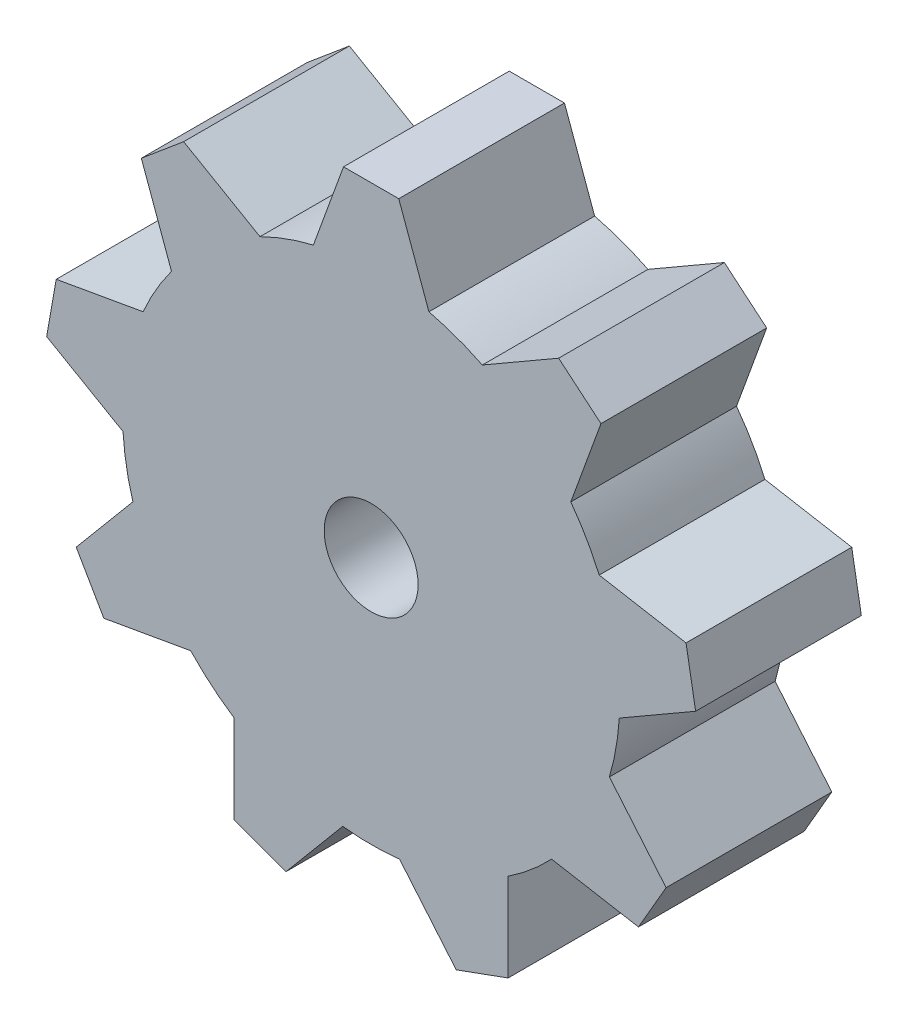
from build123d import *

# Parameters (mm, degrees)
SKETCH1_R           = 0.85
BOSS_EXTRUDE1_DEPTH = 3


with BuildPart() as part:
    # Sketch1 → Boss-Extrude1 (new body)
    with BuildSketch(Plane.XY):
        with BuildLine():
            Line((2.012075091, 4.025115381), (3.394482569, 4.82324871))
            Line((3.394482569, 4.82324871), (4.160527012, 4.1804611))
            Line((4.160527012, 4.1804611), (3.614571661, 2.6804611))
            ThreePointArc((3.614571661, 2.6804611), (3.897114317, 2.25), (4.128633237, 1.790080332))
            Line((4.128633237, 1.790080332), (5.700649018, 1.512891535))
            Line((5.700649018, 1.512891535), (5.874297196, 0.528083782))
            Line((5.874297196, 0.528083782), (4.491889718, -0.270049547))
            ThreePointArc((4.491889718, -0.270049547), (4.431634889, -0.7814168), (4.313358007, -1.282553199))
            Line((4.313358007, -1.282553199), (5.339418436, -2.505364402))
            Line((5.339418436, -2.505364402), (4.839418436, -3.371389806))
            Line((4.839418436, -3.371389806), (3.267402655, -3.09420101))
            ThreePointArc((3.267402655, -3.09420101), (2.892544244, -3.447199994), (2.479814627, -3.755065834))
            Line((2.479814627, -3.755065834), (2.479814627, -5.351332492))
            Line((2.479814627, -5.351332492), (1.540122006, -5.693352636))
            Line((1.540122006, -5.693352636), (0.514061576, -4.470541432))
            ThreePointArc((0.514061576, -4.470541432), (0, -4.5), (-0.514061576, -4.470541432))
            Line((-0.514061576, -4.470541432), (-1.540122006, -5.693352636))
            Line((-1.540122006, -5.693352636), (-2.479814627, -5.351332492))
            Line((-2.479814627, -5.351332492), (-2.479814627, -3.755065834))
            ThreePointArc((-2.479814627, -3.755065834), (-2.892544244, -3.447199994), (-3.267402655, -3.09420101))
            Line((-3.267402655, -3.09420101), (-4.839418436, -3.371389806))
            Line((-4.839418436, -3.371389806), (-5.339418436, -2.505364402))
            Line((-5.339418436, -2.505364402), (-4.313358007, -1.282553199))
            ThreePointArc((-4.313358007, -1.282553199), (-4.431634889, -0.7814168), (-4.491889718, -0.270049547))
            Line((-4.491889718, -0.270049547), (-5.874297196, 0.528083782))
            Line((-5.874297196, 0.528083782), (-5.700649018, 1.512891535))
            Line((-5.700649018, 1.512891535), (-4.128633237, 1.790080332))
            ThreePointArc((-4.128633237, 1.790080332), (-3.897114317, 2.25), (-3.614571661, 2.6804611))
            Line((-3.614571661, 2.6804611), (-4.160527012, 4.1804611))
            Line((-4.160527012, 4.1804611), (-3.394482569, 4.82324871))
            Line((-3.394482569, 4.82324871), (-2.012075091, 4.025115381))
            ThreePointArc((-2.012075091, 4.025115381), (-1.539090645, 4.228616794), (-1.045955351, 4.376754209))
            Line((-1.045955351, 4.376754209), (-0.5, 5.876754209))
            Line((-0.5, 5.876754209), (0.5, 5.876754209))
            Line((0.5, 5.876754209), (1.045955351, 4.376754209))
            ThreePointArc((1.045955351, 4.376754209), (1.539090645, 4.228616794), (2.012075091, 4.025115381))
        make_face()
        Circle(SKETCH1_R, mode=Mode.SUBTRACT)
    extrude(amount=BOSS_EXTRUDE1_DEPTH)


solid = part.part
